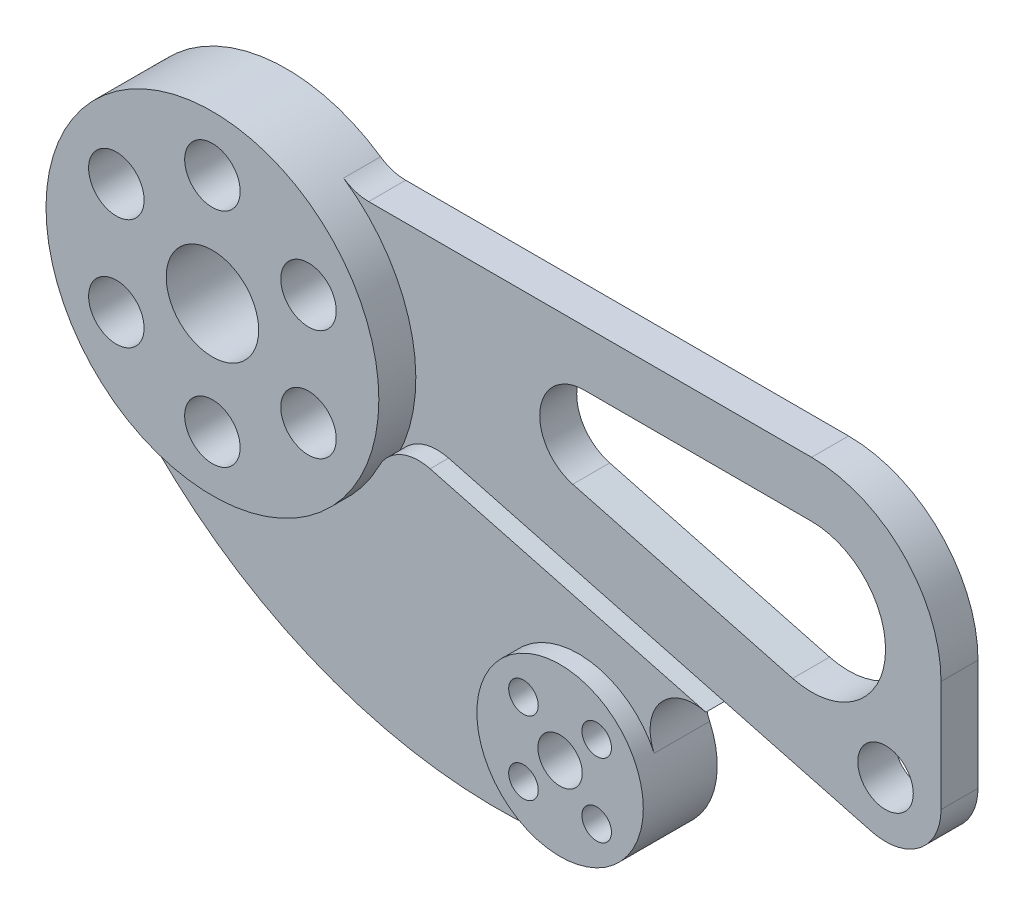
from build123d import *

# Parameters (mm, degrees)
SKETCH_5_R      = 7.5
EXTRUDE_1_DEPTH = 10
SKETCH_5_3_R    = 45
SKETCH_5_3_R_2  = 7.5
SKETCH_5_3_R_3  = 12.5
SKETCH_5_3_R_4  = 22.5
SKETCH_5_3_R_5  = 4
SKETCH_5_3_R_6  = 6
EXTRUDE_2_DEPTH = 20
EXTRUDE_3_DEPTH = 15


with BuildPart() as part:
    # Эскиз5 → Бобышка-Вытянуть1 (new body)
    with BuildSketch(Plane.XY):
        with BuildLine():
            ThreePointArc((187, 0), (176.748737342, 24.748737342), (152, 35))
            Line((152, 35), (32.249030993, 35))
            ThreePointArc((32.249030993, 35), (28.694937727, 35.538393609), (25.45976131, 37.105263158))
            ThreePointArc((25.45976131, 37.105263158), (39.816386444, 20.967960571), (45, 0))
            ThreePointArc((45, 0), (43.758881795, -10.495725989), (40.103988265, -20.41249924))
            ThreePointArc((40.103988265, -20.41249924), (45.898229653, -14.901907218), (53.868271349, -14.255151415))
            Line((53.868271349, -14.255151415), (128.412955316, -33.981898358))
            Line((128.412955316, -33.981898358), (168.162642233, -44.500851195))
            ThreePointArc((168.162642233, -44.500851195), (181.149853373, -41.886134075), (187, -30))
            Line((187, -30), (187, 0))
        make_face()
        with Locations((172, -30)):
            Circle(SKETCH_5_R, mode=Mode.SUBTRACT)
        with BuildLine():
            Line((90.497574655, 20), (152, 20))
            ThreePointArc((152, 20), (171.832919165, -2.579790186), (146.883522978, -19.33446826))
            Line((146.883522978, -19.33446826), (87.427688442, -3.600680956))
            ThreePointArc((87.427688442, -3.600680956), (78.597823156, 9.547874112), (90.497574655, 20))
        make_face(mode=Mode.SUBTRACT)
    extrude(amount=EXTRUDE_1_DEPTH)

    # Эскиз5<3> → Бобышка-Вытянуть2 (add)
    # profile 1 of 2: a face of its own
    with BuildSketch(Plane.XY):
        Circle(SKETCH_5_3_R)
        with Locations((0, -30)):
            Circle(SKETCH_5_3_R_2, mode=Mode.SUBTRACT)
        with Locations((-25.980762114, -15)):
            Circle(SKETCH_5_3_R_2, mode=Mode.SUBTRACT)
        Circle(SKETCH_5_3_R_3, mode=Mode.SUBTRACT)
        with Locations((25.980762114, -15)):
            Circle(SKETCH_5_3_R_2, mode=Mode.SUBTRACT)
        with Locations((-25.980762114, 15)):
            Circle(SKETCH_5_3_R_2, mode=Mode.SUBTRACT)
        with Locations((0, 30)):
            Circle(SKETCH_5_3_R_2, mode=Mode.SUBTRACT)
        with Locations((25.980762114, 15)):
            Circle(SKETCH_5_3_R_2, mode=Mode.SUBTRACT)
    # profile 2 of 2: a face of its own
    with BuildSketch(Plane.XY):
        with Locations((94, -60)):
            Circle(SKETCH_5_3_R_4)
        with Locations((84.100505063, -69.899494937)):
            Circle(SKETCH_5_3_R_5, mode=Mode.SUBTRACT)
        with Locations((103.899494937, -69.899494937)):
            Circle(SKETCH_5_3_R_5, mode=Mode.SUBTRACT)
        with Locations((94, -60)):
            Circle(SKETCH_5_3_R_6, mode=Mode.SUBTRACT)
        with Locations((84.100505063, -50.100505063)):
            Circle(SKETCH_5_3_R_5, mode=Mode.SUBTRACT)
        with Locations((103.899494937, -50.100505063)):
            Circle(SKETCH_5_3_R_5, mode=Mode.SUBTRACT)
    extrude(amount=EXTRUDE_2_DEPTH)


with BuildPart() as extrude_2_piece_1:
    # of the separate pieces the step leaves, piece 1, a body of its own (extrude_2_pieces)
    add(part.part.solids().sort_by_distance((168.162642233, -44.500851195, 0))[0])



with BuildPart() as extrude_2_piece_2:
    # of the separate pieces the step leaves, piece 2, a body of its own (extrude_2_pieces)
    add(part.part.solids().sort_by_distance((116.5, -60, 0))[0])


with BuildPart() as extrude_2_piece_1_1:
    add(extrude_2_piece_1.part)

    add(extrude_2_piece_2.part)  # Бобышка-Вытянуть3 merges Бобышка-Вытянуть2 piece 2
    # Эскиз5<4> → Бобышка-Вытянуть3 (add)
    with BuildSketch(Plane.XY):
        with BuildLine():
            ThreePointArc((40.103988265, -20.41249924), (2.027406196, -44.954305957), (-38.103740681, -23.9396104))
            ThreePointArc((-38.103740681, -23.9396104), (21.140554647, -74.43017402), (98.610149033, -82.02263667))
            ThreePointArc((98.610149033, -82.02263667), (73.905745166, -49.877207764), (114.441132023, -50.597334335))
            ThreePointArc((114.441132023, -50.597334335), (116.158656581, -37.859460343), (128.412955316, -33.981898358))
            Line((128.412955316, -33.981898358), (53.868271349, -14.255151415))
            ThreePointArc((53.868271349, -14.255151415), (45.898229653, -14.901907218), (40.103988265, -20.41249924))
        make_face()
    extrude(amount=EXTRUDE_3_DEPTH)


solid = extrude_2_piece_1_1.part
